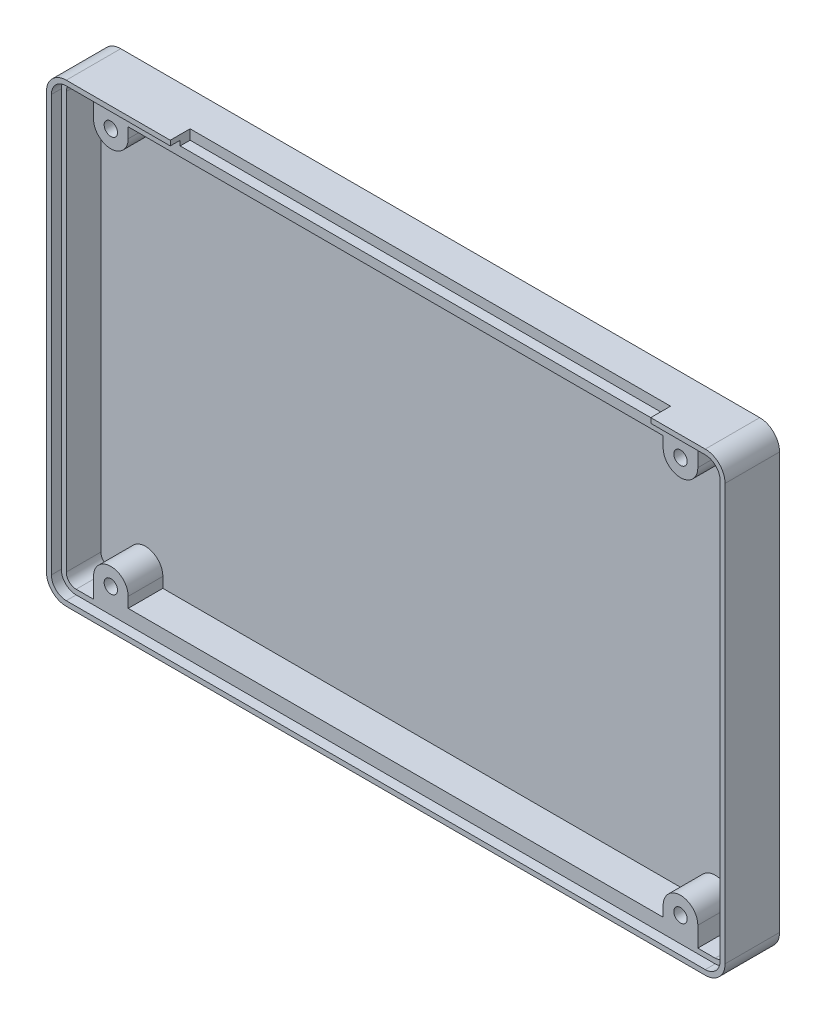
from build123d import *

# Parameters (mm, degrees)
SKETCH1_W           = 137
SKETCH1_H           = 92
BOSS_EXTRUDE1_DEPTH = 2
SKETCH2_W           = 137
SKETCH2_H           = 92
SKETCH2_W_2         = 133
SKETCH2_H_2         = 88
BOSS_EXTRUDE2_DEPTH = 7
SKETCH3_W           = 137
SKETCH3_H           = 92
SKETCH3_W_2         = 135
SKETCH3_H_2         = 90
BOSS_EXTRUDE3_DEPTH = 2
SKETCH4_R           = 1.35
BOSS_EXTRUDE4_DEPTH = 7
SKETCH8_W           = 108
SKETCH8_H           = 1.9
BOSS_EXTRUDE6_DEPTH = 7
FILLET1_R           = 2
FILLET2_R           = 3
FILLET3_R           = 4
SKETCH11_W          = 108
SKETCH11_H          = 1.9
BOSS_EXTRUDE7_DEPTH = 7
SKETCH12_W          = 97
SKETCH12_H          = 4
CUT_EXTRUDE3_DEPTH  = 2
CUT_EXTRUDE4_START  = -10
SKETCH13_R          = 1.35
CUT_EXTRUDE4_DEPTH  = 10


with BuildPart() as part:
    # Sketch1 → Boss-Extrude1 (new body)
    with BuildSketch(Plane.XY):
        with Locations((68.5, 46)):
            Rectangle(SKETCH1_W, SKETCH1_H)
    extrude(amount=BOSS_EXTRUDE1_DEPTH)

    # Sketch2 → Boss-Extrude2 (add)
    with BuildSketch(Plane.XY.offset(2)):
        with Locations((68.5, 46)):
            Rectangle(SKETCH2_W, SKETCH2_H)
        with Locations((68.5, 46)):
            Rectangle(SKETCH2_W_2, SKETCH2_H_2, mode=Mode.SUBTRACT)
    extrude(amount=BOSS_EXTRUDE2_DEPTH)

    # Sketch3 → Boss-Extrude3 (add)
    with BuildSketch(Plane.XY.offset(9)):
        with Locations((68.5, 46)):
            Rectangle(SKETCH3_W, SKETCH3_H)
        with Locations((68.5, 46)):
            Rectangle(SKETCH3_W_2, SKETCH3_H_2, mode=Mode.SUBTRACT)
    extrude(amount=BOSS_EXTRUDE3_DEPTH)

    # Sketch4 → Boss-Extrude4 (add)
    # profile 1 of 4: a face of its own
    with BuildSketch(Plane.XY.offset(2)):
        with BuildLine():
            Line((7.5, 6), (7.5, 2))
            Line((7.5, 2), (14.5, 2))
            Line((14.5, 2), (14.5, 6))
            ThreePointArc((14.5, 6), (11, 9.5), (7.5, 6))
        make_face()
        with Locations((11, 6)):
            Circle(SKETCH4_R, mode=Mode.SUBTRACT)
    # profile 2 of 4: a face of its own
    with BuildSketch(Plane.XY.offset(2)):
        with BuildLine():
            Line((122.5, 6), (122.5, 2))
            Line((122.5, 2), (129.5, 2))
            Line((129.5, 2), (129.5, 6))
            ThreePointArc((129.5, 6), (126, 9.5), (122.5, 6))
        make_face()
        with Locations((126, 6)):
            Circle(SKETCH4_R, mode=Mode.SUBTRACT)
    # profile 3 of 4: a face of its own
    with BuildSketch(Plane.XY.offset(2)):
        with BuildLine():
            Line((129.5, 86), (129.5, 90))
            Line((129.5, 90), (122.5, 90))
            Line((122.5, 90), (122.5, 86))
            ThreePointArc((122.5, 86), (126, 82.5), (129.5, 86))
        make_face()
        with Locations((126, 86)):
            Circle(SKETCH4_R, mode=Mode.SUBTRACT)
    # profile 4 of 4: a face of its own
    with BuildSketch(Plane.XY.offset(2)):
        with BuildLine():
            Line((14.5, 86), (14.5, 90))
            Line((14.5, 90), (7.5, 90))
            Line((7.5, 90), (7.5, 86))
            ThreePointArc((7.5, 86), (11, 82.5), (14.5, 86))
        make_face()
        with Locations((11, 86)):
            Circle(SKETCH4_R, mode=Mode.SUBTRACT)
    extrude(amount=BOSS_EXTRUDE4_DEPTH)

    # Sketch8 → Boss-Extrude6 (add)
    with BuildSketch(Plane.XY.offset(2)):
        with Locations((68.5, 2.95)):
            Rectangle(SKETCH8_W, SKETCH8_H)
    extrude(amount=BOSS_EXTRUDE6_DEPTH)

    # Fillet1
    fillet1_edges = [part.edges().sort_by_distance(p)[0] for p in [
        (2, 2, 5.5),
        (135, 2, 5.5),
        (135, 90, 5.5),
        (2, 90, 5.5),
    ]]
    fillet(fillet1_edges, radius=FILLET1_R)

    # Fillet2
    fillet2_edges = [part.edges().sort_by_distance(p)[0] for p in [
        (1, 1, 10),
        (136, 1, 10),
        (136, 91, 10),
        (1, 91, 10),
    ]]
    fillet(fillet2_edges, radius=FILLET2_R)

    # Fillet3
    fillet3_edges = [part.edges().sort_by_distance(p)[0] for p in [
        (0, 92, 5.5),
        (137, 92, 5.5),
        (137, 0, 5.5),
        (0, 0, 5.5),
    ]]
    fillet(fillet3_edges, radius=FILLET3_R)

    # Sketch11 → Boss-Extrude7 (add)
    with BuildSketch(Plane.XY.offset(2)):
        with Locations((68.5, 89.05)):
            Rectangle(SKETCH11_W, SKETCH11_H)
    extrude(amount=BOSS_EXTRUDE7_DEPTH)

    # Sketch12 → Cut-Extrude3 (cut)
    with BuildSketch(Plane(origin=(0, 92, 0), x_dir=(1, 0, 0), z_dir=(0, 1, 0))):
        with Locations((73.5, -9)):
            Rectangle(SKETCH12_W, SKETCH12_H)
    extrude(amount=-CUT_EXTRUDE3_DEPTH, mode=Mode.SUBTRACT)

    # Sketch13 → Cut-Extrude4 (cut)
    with BuildSketch(Plane.XY.offset(9).offset(CUT_EXTRUDE4_START)):
        with Locations(Location((11, 86, 0), (0, 0, 180))):
            Circle(SKETCH13_R)
        with Locations(Location((11, 6, 0), (0, 0, 180))):
            Circle(SKETCH13_R)
        with Locations(Location((126, 6, 0), (0, 0, 180))):
            Circle(SKETCH13_R)
        with Locations(Location((126, 86, 0), (0, 0, 180))):
            Circle(SKETCH13_R)
    extrude(amount=CUT_EXTRUDE4_DEPTH, mode=Mode.SUBTRACT)


solid = part.part
